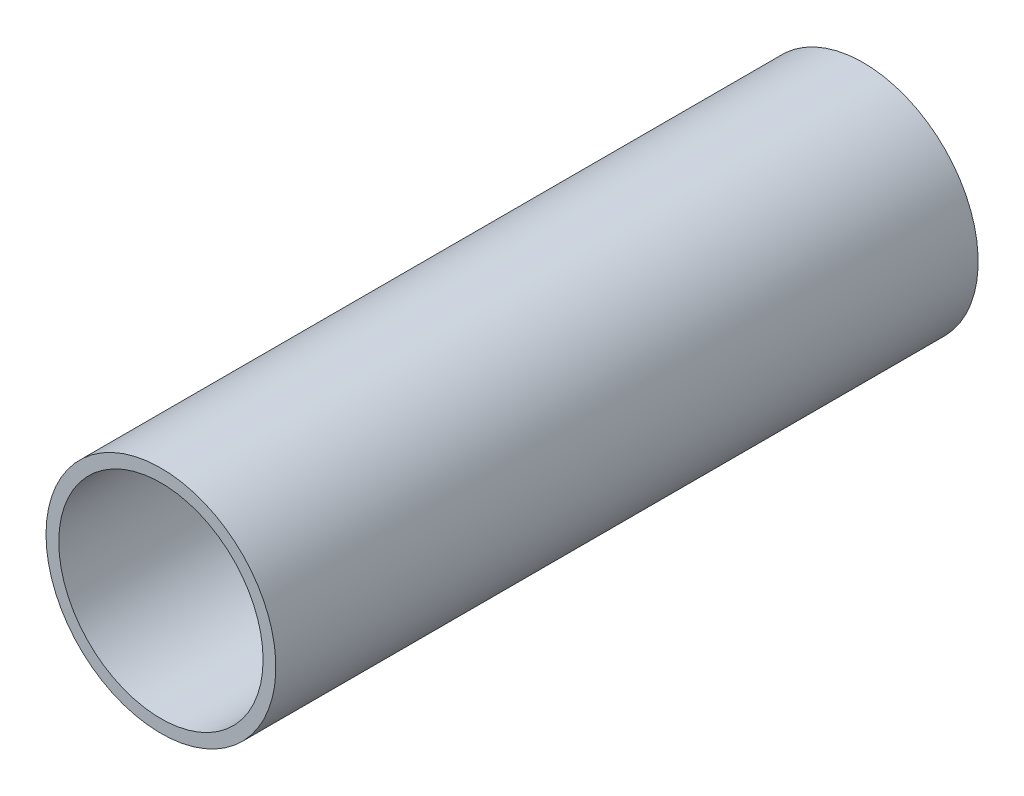
from build123d import *

# Parameters (mm, degrees)
SKETCH1_R           = 18
SKETCH1_R_2         = 16
BOSS_EXTRUDE1_DEPTH = 110


with BuildPart() as part:
    # Sketch1 → Boss-Extrude1 (new body)
    with BuildSketch(Plane.XY):
        with Locations(Location((0, 0, 0), (0, 0, 180))):
            Circle(SKETCH1_R)
        with Locations(Location((0, 0, 0), (0, 0, 180))):
            Circle(SKETCH1_R_2, mode=Mode.SUBTRACT)
    extrude(amount=BOSS_EXTRUDE1_DEPTH)


solid = part.part
